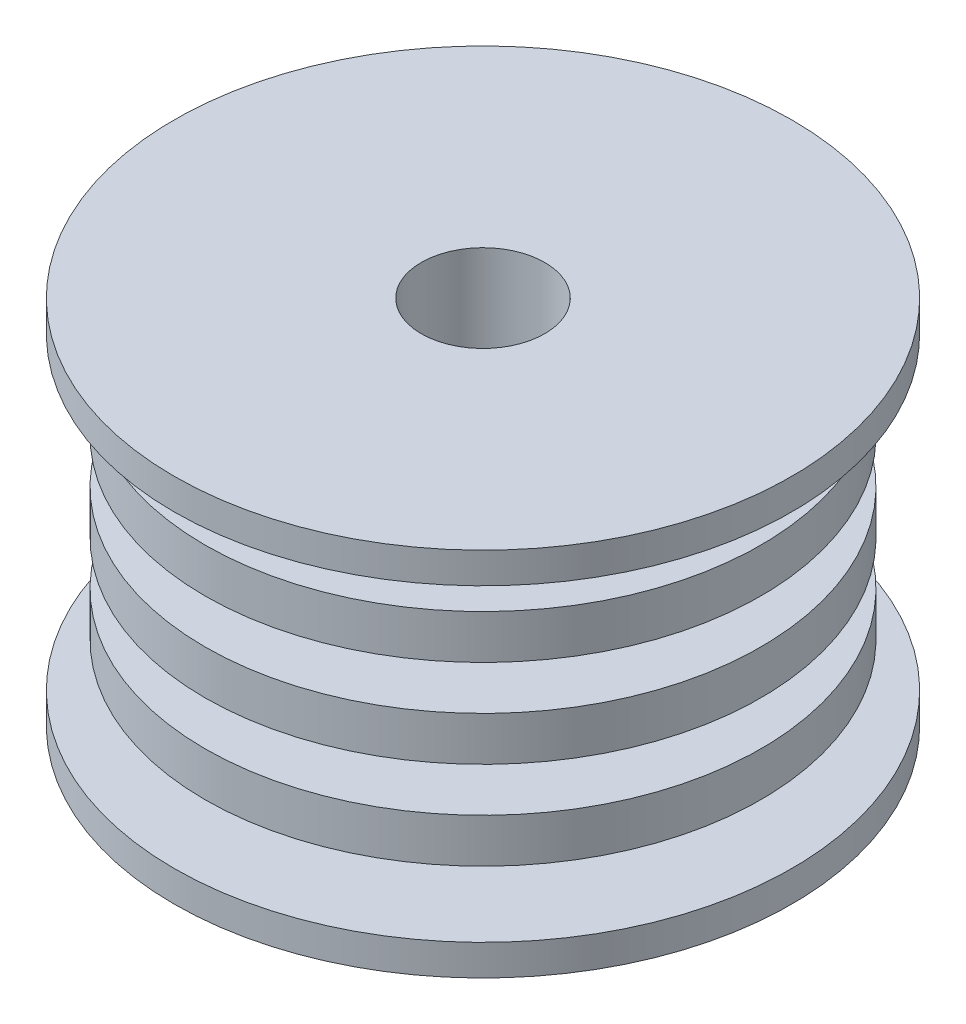
from build123d import *

# Parameters (mm, degrees)
SKETCH3_R          = 4
CUT_EXTRUDE1_DEPTH = 38.094473982


with BuildPart() as part:
    # Sketch2 → Revolve1 (revolve)
    with BuildSketch(Plane(origin=(0, 0, 0), x_dir=(0, 0, -1), z_dir=(1, 0, 0))):
        Polygon((0, -12), (0, 12), (20, 12), (20, 10), (12, 10), (12, 7.142857143), (18, 7.142857143), (18, 4.285714286), (12, 4.285714286), (12, 1.428571429), (18, 1.428571429), (18, -1.428571429), (12, -1.428571429), (12, -4.285714286), (18, -4.285714286), (18, -7.142857143), (12, -7.142857143), (12, -10), (20, -10), (20, -12), align=None)
    revolve(axis=Axis((0, -52.077930442, 0), (0, 1, 0)))

    # Sketch3 → Cut-Extrude1 (cut, through all)
    with BuildSketch(Plane(origin=(0, 12, 0), x_dir=(1, 0, 0), z_dir=(0, 1, 0))):
        with Locations(Location((0, 0, 0), (0, 0, 270))):
            Circle(SKETCH3_R)
    extrude(amount=-CUT_EXTRUDE1_DEPTH, mode=Mode.SUBTRACT)


solid = part.part
